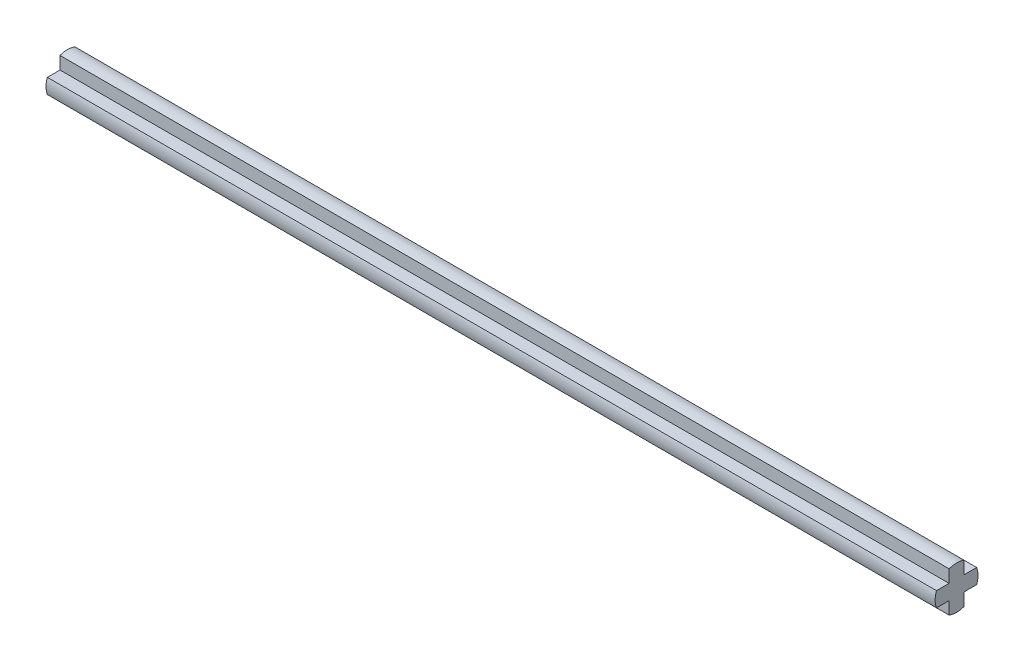
from build123d import *

# Parameters (mm, degrees)
BOSS_EXTRUDE1_DEPTH = 95.4


with BuildPart() as part:
    # Sketch1 → Boss-Extrude1 (new body)
    with BuildSketch(Plane(origin=(0, 0, 0), x_dir=(0, 0, -1), z_dir=(1, 0, 0))):
        with BuildLine():
            Line((-2.156385865, 0.8), (-0.8, 0.8))
            Line((-0.8, 0.8), (-0.8, 2.156385865))
            add(Edge.make_bspline(
                [(-0.8, 2.156385865), (0, 2.443614135), (0.8, 2.156385865)],
                knots=[0, 0, 0, 1, 1, 1], degree=2))
            Line((0.8, 2.156385865), (0.8, 0.8))
            Line((0.8, 0.8), (2.156385865, 0.8))
            add(Edge.make_bspline(
                [(2.156385865, 0.8), (2.443614135, 0), (2.156385865, -0.8)],
                knots=[0, 0, 0, 1, 1, 1], degree=2))
            Line((2.156385865, -0.8), (0.8, -0.8))
            Line((0.8, -0.8), (0.8, -2.156385865))
            add(Edge.make_bspline(
                [(0.8, -2.156385865), (0, -2.443614135), (-0.8, -2.156385865)],
                knots=[0, 0, 0, 1, 1, 1], degree=2))
            Line((-0.8, -2.156385865), (-0.8, -0.8))
            Line((-0.8, -0.8), (-2.156385865, -0.8))
            add(Edge.make_bspline(
                [(-2.156385865, -0.8), (-2.443614135, 0), (-2.156385865, 0.8)],
                knots=[0, 0, 0, 1, 1, 1], degree=2))
        make_face()
    extrude(amount=BOSS_EXTRUDE1_DEPTH)


solid = part.part
